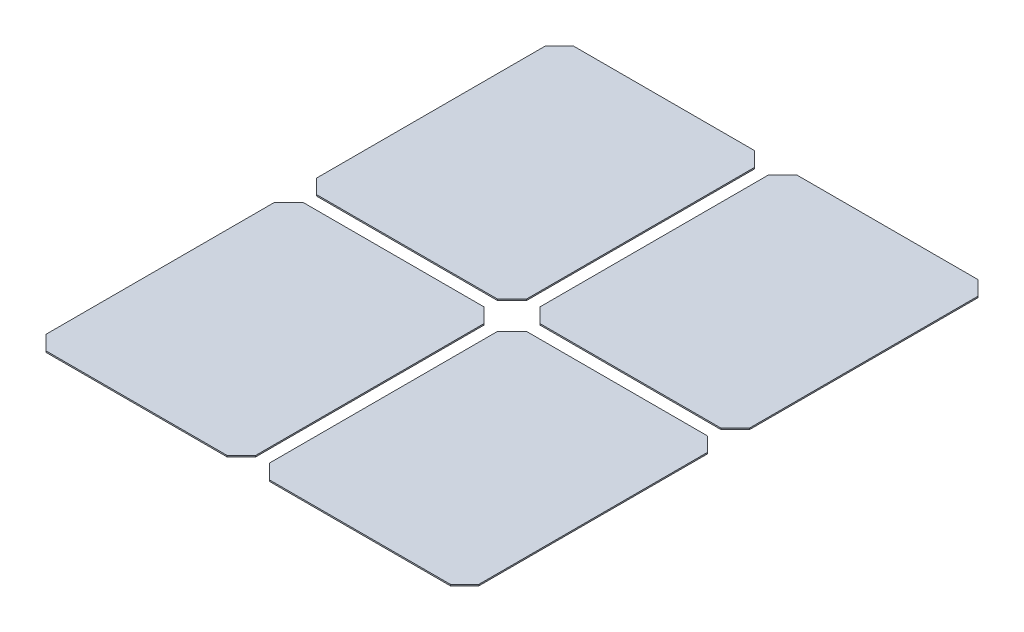
from build123d import *

# Parameters (mm, degrees)
BOSS_EXTRUDE1_DEPTH   = 1
BOSS_EXTRUDE1_2_DEPTH = 1
BOSS_EXTRUDE1_3_DEPTH = 1
BOSS_EXTRUDE1_4_DEPTH = 1


with BuildPart() as part:
    # Sketch1 → Boss-Extrude1 (new body)
    with BuildSketch(Plane(origin=(0, 0, 0), x_dir=(1, 0, 0), z_dir=(0, 1, 0))):
        Polygon((-168, 202.393398282), (-157.393398282, 213), (-23.606601718, 213), (-13, 202.393398282), (-13, 33.606601718), (-23.606601718, 23), (-157.393398282, 23), (-168, 33.606601718), align=None)
    extrude(amount=BOSS_EXTRUDE1_DEPTH)


with BuildPart() as body_2:
    # Sketch1 → Boss-Extrude1 2 (new body)
    with BuildSketch(Plane(origin=(0, 0, 0), x_dir=(1, 0, 0), z_dir=(0, 1, 0))):
        Polygon((-333, 202.393398282), (-322.393398282, 213), (-188.606601718, 213), (-178, 202.393398282), (-178, 33.606601718), (-188.606601718, 23), (-322.393398282, 23), (-333, 33.606601718), align=None)
    extrude(amount=BOSS_EXTRUDE1_2_DEPTH)


with BuildPart() as body_3:
    # Sketch1 → Boss-Extrude1 3 (new body)
    with BuildSketch(Plane(origin=(0, 0, 0), x_dir=(1, 0, 0), z_dir=(0, 1, 0))):
        Polygon((-333, 402.393398282), (-322.393398282, 413), (-188.606601718, 413), (-178, 402.393398282), (-178, 233.606601718), (-188.606601718, 223), (-322.393398282, 223), (-333, 233.606601718), align=None)
    extrude(amount=BOSS_EXTRUDE1_3_DEPTH)


with BuildPart() as body_4:
    # Sketch1 → Boss-Extrude1 4 (new body)
    with BuildSketch(Plane(origin=(0, 0, 0), x_dir=(1, 0, 0), z_dir=(0, 1, 0))):
        Polygon((-168, 402.393398282), (-157.393398282, 413), (-23.606601718, 413), (-13, 402.393398282), (-13, 233.606601718), (-23.606601718, 223), (-157.393398282, 223), (-168, 233.606601718), align=None)
    extrude(amount=BOSS_EXTRUDE1_4_DEPTH)


solid = Compound([part.part, body_2.part, body_3.part, body_4.part])
